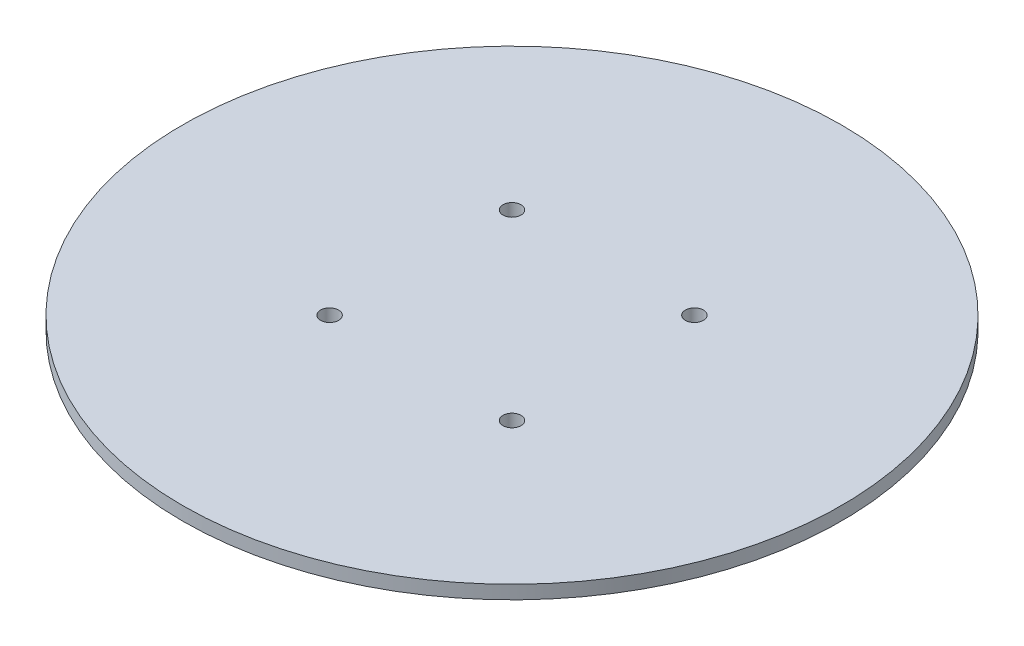
from build123d import *

# Parameters (mm, degrees)
BOSS_EXTRUDE1_DEPTH      = 1.5
BOSS_EXTRUDE1_DEPTH_BACK = 1.5
SKETCH1_R                = 73.2
SKETCH1_R_2              = 2


with BuildPart() as part:
    # Sketch1 → Boss-Extrude1 (new, two sides: drawn at the far end of the back side and taken through both)
    with BuildSketch(Plane(origin=(0, 0, 0), x_dir=(1, 0, 0), z_dir=(0, 1, 0)).offset(-BOSS_EXTRUDE1_DEPTH_BACK)):
        Circle(SKETCH1_R)
        with Locations((20.253785579, 20.253785579)):
            Circle(SKETCH1_R_2, mode=Mode.SUBTRACT)
        with Locations((20.253785579, -20.253785579)):
            Circle(SKETCH1_R_2, mode=Mode.SUBTRACT)
        with Locations((-20.253785579, -20.253785579)):
            Circle(SKETCH1_R_2, mode=Mode.SUBTRACT)
        with Locations((-20.253785579, 20.253785579)):
            Circle(SKETCH1_R_2, mode=Mode.SUBTRACT)
    extrude(amount=BOSS_EXTRUDE1_DEPTH + BOSS_EXTRUDE1_DEPTH_BACK)


solid = part.part
